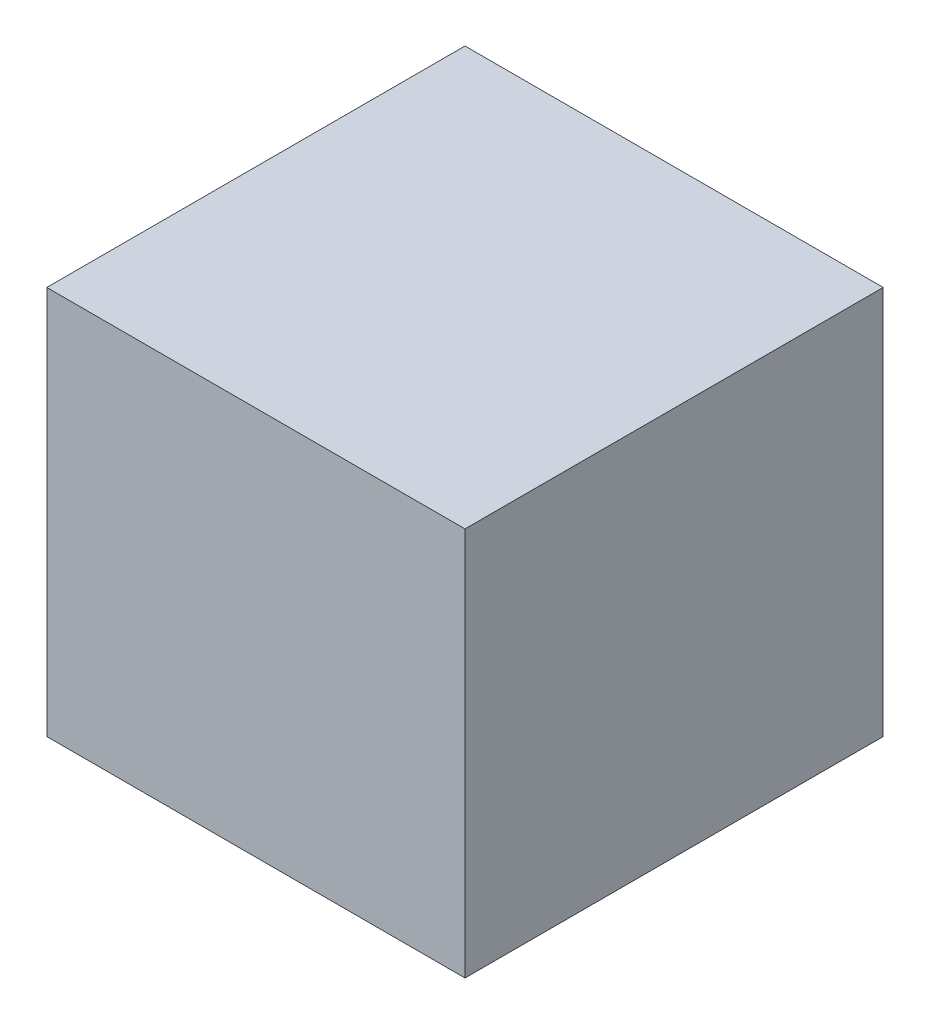
from build123d import *

# Parameters (mm, degrees)
SKETCH_1_W      = 100
SKETCH_1_H      = 100
EXTRUDE_1_DEPTH = 3
SKETCH_1_3_W    = 100
SKETCH_1_3_H    = 100
SKETCH_1_3_W_2  = 94
SKETCH_1_3_H_2  = 94
EXTRUDE_2_DEPTH = 90


with BuildPart() as part:
    # 草图1 → 凸台-拉伸1 (new body)
    with BuildSketch(Plane(origin=(0, 0, 0), x_dir=(1, 0, 0), z_dir=(0, 1, 0))):
        with Locations((50, -50)):
            Rectangle(SKETCH_1_W, SKETCH_1_H)
    extrude(amount=EXTRUDE_1_DEPTH)

    # 草图1<3> → 凸台-拉伸2 (add)
    with BuildSketch(Plane(origin=(0, 0, 0), x_dir=(1, 0, 0), z_dir=(0, 1, 0))):
        with Locations((50, -50)):
            Rectangle(SKETCH_1_3_W, SKETCH_1_3_H)
        with Locations((50, -50)):
            Rectangle(SKETCH_1_3_W_2, SKETCH_1_3_H_2, mode=Mode.SUBTRACT)
    extrude(amount=-EXTRUDE_2_DEPTH)


solid = part.part
